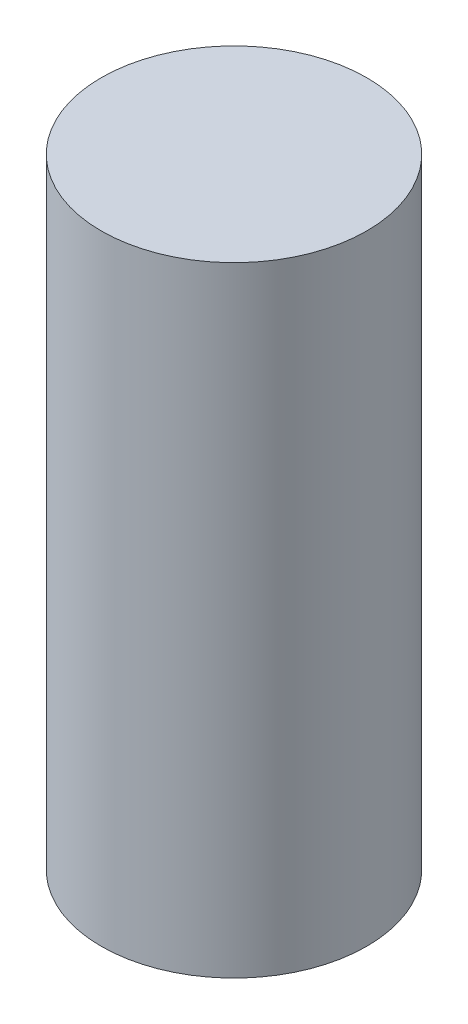
from build123d import *

# Parameters (mm, degrees)
SKETCH_1_R      = 6
EXTRUDE_1_DEPTH = 28


with BuildPart() as part:
    # 草图1 → 凸台-拉伸1 (new body)
    with BuildSketch(Plane(origin=(0, 0, 0), x_dir=(1, 0, 0), z_dir=(0, 1, 0))):
        with Locations(Location((0, 0, 0), (0, 0, 270))):
            Circle(SKETCH_1_R)
    extrude(amount=EXTRUDE_1_DEPTH)


solid = part.part
